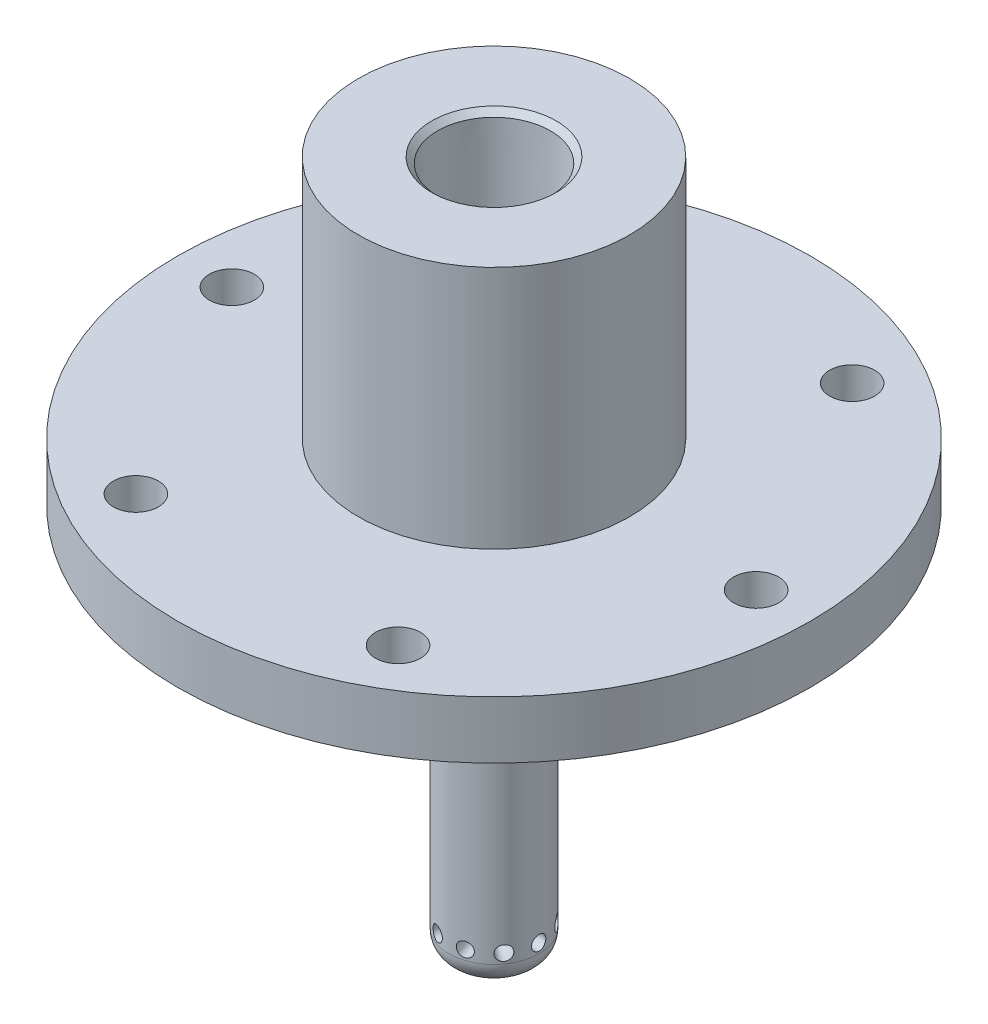
from build123d import *

# Parameters (mm, degrees)
F_10_CLEARANCE_HOLE2_D         = 4.9784
F_10_CLEARANCE_HOLE2_DEPTH     = 73.5
F_10_CLEARANCE_HOLE2_TIP       = 1.495662253
F_10_CLEARANCE_HOLE1_D         = 4.9784
SKETCH5_R                      = 24.384
SKETCH5_R_2                    = 20.32
CUT_EXTRUDE1_DEPTH             = 2.667
CIRPATTERN1_COUNT              = 6
F_1_16_0_0625_DIAMETER_HOLE1_D = 1.5875
CIRPATTERN3_COUNT              = 5
FILLET1_R                      = 0.508
FILLET2_R                      = 0.127


with BuildPart() as part:
    # Sketch1 → Revolve1 (revolve)
    with BuildSketch(Plane.XY, mode=Mode.PRIVATE) as revolve1_sk:
        with BuildLine():
            Line((0, 0), (-15, 0))
            Line((-15, 0), (-15, -27))
            Line((-15, -27), (-35, -27))
            Line((-35, -27), (-35, -33.35))
            Line((-35, -33.35), (-16, -33.35))
            Line((-16, -33.35), (-16, -37.35))
            Line((-16, -37.35), (-10, -37.35))
            Line((-10, -37.35), (-10, -41.35))
            Line((-10, -41.35), (-5, -46.35))
            Line((-5, -46.35), (-5, -73.85))
            ThreePointArc((-5, -73.85), (-4.267766953, -75.617766953), (-2.5, -76.35))
            Line((-2.5, -76.35), (0, -76.35))
            Line((0, -76.35), (0, 0))
        make_face()
    revolve(revolve1_sk.sketch.rotate(Axis((0, -76.35, 0), (0, 1, 0)), 270), axis=Axis((0, -76.35, 0), (0, 1, 0)))

    # #10 Clearance Hole2
    with Locations(Plane(origin=(0, 0, 0), x_dir=(1, 0, 0), z_dir=(0, 1, 0))):
        with Locations((0, 0)):
            Hole(F_10_CLEARANCE_HOLE2_D / 2, depth=F_10_CLEARANCE_HOLE2_DEPTH)
            with Locations((0, 0, -(F_10_CLEARANCE_HOLE2_DEPTH + F_10_CLEARANCE_HOLE2_TIP / 2))):  # 118° drill point
                Cone(0, F_10_CLEARANCE_HOLE2_D / 2, F_10_CLEARANCE_HOLE2_TIP, mode=Mode.SUBTRACT)

    # Sketch4 → 1/4 NPT Tapped Hole0 (revolve, cut)
    with BuildSketch(Plane(origin=(0, 0, 0), x_dir=(0, 0, 1), z_dir=(1, 0, 0))):
        Polygon((0, 0), (0, 20.412347279), (5.5626, 17.07), (5.5626, 10.02), (5.962688832, 10.02), (6.2436883, 0.635), (6.8786883, 0), align=None)
    revolve(axis=Axis((0, 6.35, 0), (0, -1, 0)), mode=Mode.SUBTRACT)

    # #10 Clearance Hole1 (through all)
    with Locations(Plane(origin=(0, -27, 0), x_dir=(1, 0, 0), z_dir=(0, 1, 0))):
        with Locations((29, 0)):
            f_10_clearance_hole1 = Hole(F_10_CLEARANCE_HOLE1_D / 2)

    # Sketch5 → Cut-Extrude1 (cut)
    with BuildSketch(Plane(origin=(0, -33.35, 0), x_dir=(-1, 0, 0), z_dir=(0, -1, 0))):
        with Locations(Location((0, 0, 0), (0, 0, 90))):
            Circle(SKETCH5_R)
        with Locations(Location((0, 0, 0), (0, 0, 90))):
            Circle(SKETCH5_R_2, mode=Mode.SUBTRACT)
    extrude(amount=-CUT_EXTRUDE1_DEPTH, mode=Mode.SUBTRACT)

    # CirPattern1: #10 Clearance Hole1 ×6 about axis
    cirpattern1_axis = Axis((0, 0, 0), (0, 1, 0))
    for i in range(1, CIRPATTERN1_COUNT):
        add(f_10_clearance_hole1.rotate(cirpattern1_axis, i * 360 / CIRPATTERN1_COUNT), mode=Mode.SUBTRACT)

    # 1/16 (0.0625) Diameter Hole1 (through all)
    with Locations(Plane(origin=(5, 0, 0), x_dir=(0, 0, -1), z_dir=(1, 0, 0))):
        with Locations((0, -72.8)):
            f_1_16_0_0625_diameter_hole1 = Hole(F_1_16_0_0625_DIAMETER_HOLE1_D / 2)

    # CirPattern3: 1/16 (0.0625) Diameter Hole1 ×5 about axis
    cirpattern3_axis = Axis((0, -73.85, 0), (0, -1, 0))
    for i in range(1, CIRPATTERN3_COUNT):
        add(f_1_16_0_0625_diameter_hole1.rotate(cirpattern3_axis, i * 360 / CIRPATTERN3_COUNT), mode=Mode.SUBTRACT)

    # Fillet1
    fillet1_edges = [part.edges().sort_by_distance(p)[0] for p in [
        (0, -30.683, 24.384),
        (0, -30.683, 20.32),
    ]]
    fillet(fillet1_edges, radius=FILLET1_R)

    # Fillet2
    fillet2_edges = [part.edges().sort_by_distance(p)[0] for p in [
        (0, -33.35, 24.384),
        (0, -33.35, 20.32),
    ]]
    fillet(fillet2_edges, radius=FILLET2_R)


solid = part.part
